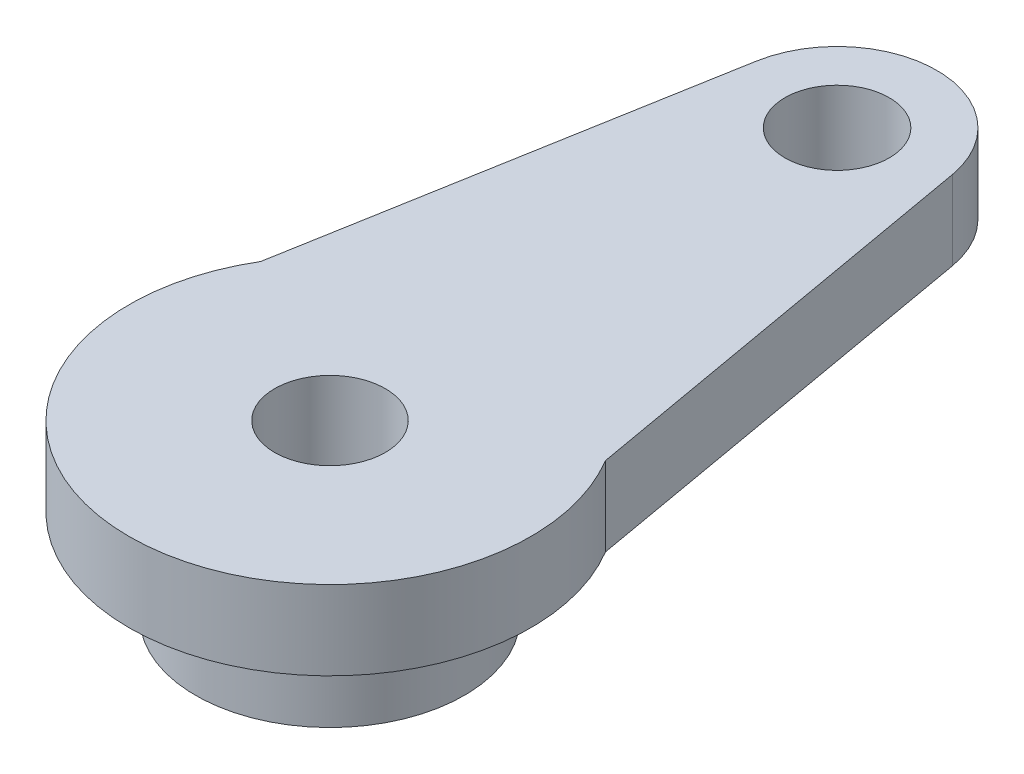
from build123d import *

# Parameters (mm, degrees)
BASES_R             = 6.35
BASE_DEPTH          = 5.4
TOPBORES_R          = 1.75
TOP_BORE_DEPTH      = 11.478788098
HORN_START          = -2.5
HORN_HALF_DEPTH     = 2.5
HORNATTACHS_R       = 1.65
HORN_ATTACH_DEPTH   = 21.913031822
HOLDINGSHAFTS_R     = 6.35
HOLDINGSHAFTS_R_2   = 4.25
HOLDING_SHAFT_DEPTH = 2.9
SKETCH3_R           = 3.025
CUT_EXTRUDE2_DEPTH  = 2.9


with BuildPart() as part:
    # BaseS → BASE (new body)
    with BuildSketch(Plane(origin=(0, 0, 0), x_dir=(1, 0, 0), z_dir=(0, 1, 0))):
        with Locations(Location((0, 0, 0), (0, 0, 90))):
            Circle(BASES_R)
    extrude(amount=BASE_DEPTH)

    # TopBoreS → TOP BORE (cut, through all)
    with BuildSketch(Plane(origin=(0, 5.4, 0), x_dir=(1, 0, 0), z_dir=(0, 1, 0))):
        with Locations(Location((0, 0, 0), (0, 0, 270))):
            Circle(TOPBORES_R)
    extrude(amount=-TOP_BORE_DEPTH, mode=Mode.SUBTRACT)

    # HornHalfS → HORN HALF (add)
    with BuildSketch(Plane(origin=(0, 5.4, 0), x_dir=(1, 0, 0), z_dir=(0, 1, 0)).offset(HORN_START)):
        with BuildLine():
            Line((-3.102144422, 16.57699176), (-5.450702003, 3.257659846))
            ThreePointArc((-5.450702003, 3.257659846), (0, 6.35), (5.450702003, 3.257659846))
            Line((5.450702003, 3.257659846), (3.102144422, 16.57699176))
            ThreePointArc((3.102144422, 16.57699176), (0, 19.18), (-3.102144422, 16.57699176))
        make_face()
    extrude(amount=HORN_HALF_DEPTH)

    # HornAttachS → HORN ATTACH (cut, through all)
    with BuildSketch(Plane(origin=(0, 5.4, 0), x_dir=(1, 0, 0), z_dir=(0, 1, 0))):
        with Locations(Location((0, 16.03, 0), (0, 0, 270))):
            Circle(HORNATTACHS_R)
    extrude(amount=-HORN_ATTACH_DEPTH, mode=Mode.SUBTRACT)

    # HoldingShaftS → HOLDING SHAFT (cut)
    with BuildSketch(Plane.XZ):
        Circle(HOLDINGSHAFTS_R)
        with Locations(Location((0, 0, 0), (0, 0, 270))):
            Circle(HOLDINGSHAFTS_R_2, mode=Mode.SUBTRACT)
    extrude(amount=-HOLDING_SHAFT_DEPTH, mode=Mode.SUBTRACT)

    # Sketch3 → Cut-Extrude2 (cut)
    with BuildSketch(Plane.XZ):
        with Locations(Location((0, 0, 0), (0, 0, 270))):
            Circle(SKETCH3_R)
    extrude(amount=-CUT_EXTRUDE2_DEPTH, mode=Mode.SUBTRACT)


solid = part.part
